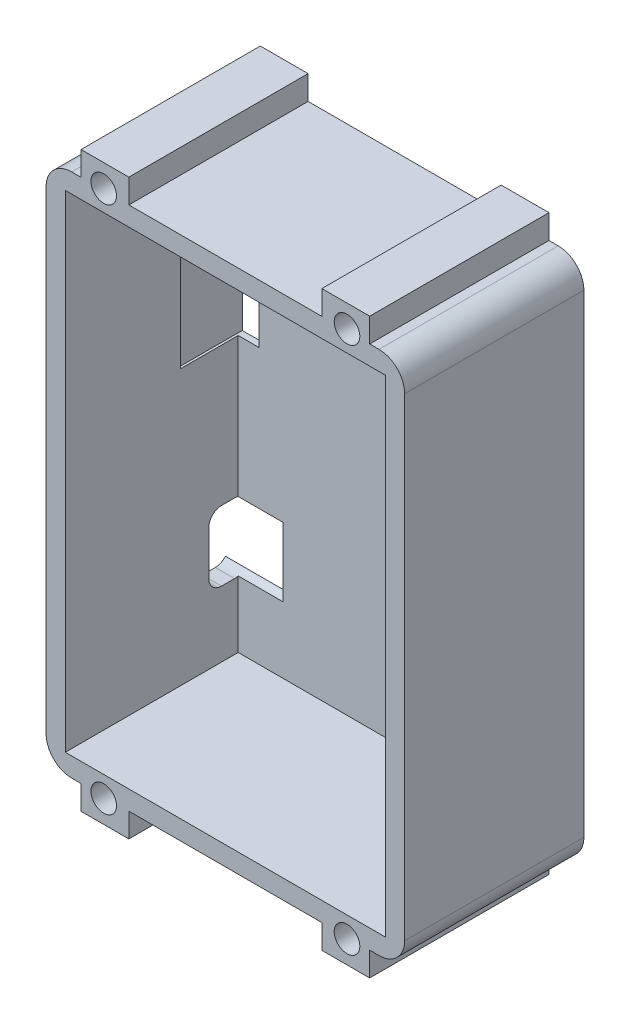
from build123d import *

# Parameters (mm, degrees)
CROQUIS1_W              = 50
CROQUIS1_H              = 76
SALIENTE_EXTRUIR1_DEPTH = 28
CROQUIS2_R              = 2
CORTAR_EXTRUIR1_DEPTH   = 28
CROQUIS3_W              = 51.795240056
CROQUIS3_H              = 77.113165798
SALIENTE_EXTRUIR2_DEPTH = 1
CROQUIS4_W              = 3.63093588
CROQUIS4_H              = 19.245174354
CORTAR_EXTRUIR2_DEPTH   = 10
SALIENTE_EXTRUIR3_DEPTH = 3.2
CROQUIS6_R              = 0.9
CORTAR_EXTRUIR3_DEPTH   = 10
CORTAR_EXTRUIR4_DEPTH   = 10


with BuildPart() as part:
    # Croquis1 → Saliente-Extruir1 (new body)
    with BuildSketch(Plane.XY):
        with BuildLine():
            Line((-24, 41), (-22.544096538, 41))
            Line((-22.544096538, 41), (-22.544096538, 44.762632311))
            Line((-22.544096538, 44.762632311), (-15.074666962, 44.762632311))
            Line((-15.074666962, 44.762632311), (-15.074666962, 41))
            Line((-15.074666962, 41), (15.074666962, 41))
            Line((15.074666962, 41), (15.074666962, 44.762632311))
            Line((15.074666962, 44.762632311), (22.544096538, 44.762632311))
            Line((22.544096538, 44.762632311), (22.544096538, 41))
            Line((22.544096538, 41), (24, 41))
            ThreePointArc((24, 41), (26.828427125, 39.828427125), (28, 37))
            Line((28, 37), (28, -37))
            ThreePointArc((28, -37), (26.828427125, -39.828427125), (24, -41))
            Line((24, -41), (22.544096538, -41))
            Line((22.544096538, -41), (22.544096538, -44.762632311))
            Line((22.544096538, -44.762632311), (15.074666962, -44.762632311))
            Line((15.074666962, -44.762632311), (15.074666962, -41))
            Line((15.074666962, -41), (-15.074666962, -41))
            Line((-15.074666962, -41), (-15.074666962, -44.762632311))
            Line((-15.074666962, -44.762632311), (-22.544096538, -44.762632311))
            Line((-22.544096538, -44.762632311), (-22.544096538, -41))
            Line((-22.544096538, -41), (-24, -41))
            ThreePointArc((-24, -41), (-26.828427125, -39.828427125), (-28, -37))
            Line((-28, -37), (-28, 37))
            ThreePointArc((-28, 37), (-26.828427125, 39.828427125), (-24, 41))
        make_face()
        Rectangle(CROQUIS1_W, CROQUIS1_H, mode=Mode.SUBTRACT)
    extrude(amount=SALIENTE_EXTRUIR1_DEPTH)

    # Croquis2 → Cortar-Extruir1 (cut)
    with BuildSketch(Plane.XY.offset(28)):
        with Locations((-19, 41.25)):
            Circle(CROQUIS2_R)
        with Locations((19, 41.25)):
            Circle(CROQUIS2_R)
        with Locations((-19, -41.25)):
            Circle(CROQUIS2_R)
        with Locations((19, -41.25)):
            Circle(CROQUIS2_R)
    extrude(amount=-CORTAR_EXTRUIR1_DEPTH, mode=Mode.SUBTRACT)

    # Croquis3 → Saliente-Extruir2 (add)
    with BuildSketch(Plane(origin=(0, 0, 0), x_dir=(-1, 0, 0), z_dir=(0, 0, -1))):
        Rectangle(CROQUIS3_W, CROQUIS3_H)
    extrude(amount=-SALIENTE_EXTRUIR2_DEPTH)

    # Croquis4 → Cortar-Extruir2 (cut)
    with BuildSketch(Plane(origin=(0, 0, 0), x_dir=(-1, 0, 0), z_dir=(0, 0, -1))):
        with Locations((23.544656322, 14.5)):
            Rectangle(CROQUIS4_W, CROQUIS4_H)
    extrude(amount=-CORTAR_EXTRUIR2_DEPTH, mode=Mode.SUBTRACT)

    # Croquis5 → Saliente-Extruir3 (add)
    with BuildSketch(Plane.XY.offset(1)):
        with BuildLine():
            Line((8.6, -32.204355183), (8.6, -11.804355183))
            ThreePointArc((8.6, -11.804355183), (6.6, -9.804355183), (4.6, -11.804355183))
            Line((4.6, -11.804355183), (4.6, -32.204355183))
            ThreePointArc((4.6, -32.204355183), (6.6, -34.204355183), (8.6, -32.204355183))
        make_face()
    extrude(amount=SALIENTE_EXTRUIR3_DEPTH)

    # Croquis6 → Cortar-Extruir3 (cut)
    with BuildSketch(Plane.XY.offset(4.2)):
        with Locations((6.6, -32.204355183)):
            Circle(CROQUIS6_R)
        with Locations((6.6, -11.804355183)):
            Circle(CROQUIS6_R)
    extrude(amount=-CORTAR_EXTRUIR3_DEPTH, mode=Mode.SUBTRACT)

    # Croquis7 → Cortar-Extruir4 (cut)
    with BuildSketch(Plane.ZY.offset(28)):
        with BuildLine():
            Line((3.589785913, -27.724097248), (1.561156319, -27.724097248))
            ThreePointArc((1.561156319, -27.724097248), (0.146942756, -27.13831081), (-0.438843681, -25.724097248))
            Line((-0.438843681, -25.724097248), (-0.438843681, -18.821747943))
            ThreePointArc((-0.438843681, -18.821747943), (0.146942756, -17.407534381), (1.561156319, -16.821747943))
            Line((1.561156319, -16.821747943), (3.589785913, -16.821747943))
            ThreePointArc((3.589785913, -16.821747943), (5.003999475, -17.407534381), (5.589785913, -18.821747943))
            Line((5.589785913, -18.821747943), (5.589785913, -25.724097248))
            ThreePointArc((5.589785913, -25.724097248), (5.003999475, -27.13831081), (3.589785913, -27.724097248))
        make_face()
    extrude(amount=-CORTAR_EXTRUIR4_DEPTH, mode=Mode.SUBTRACT)


solid = part.part
